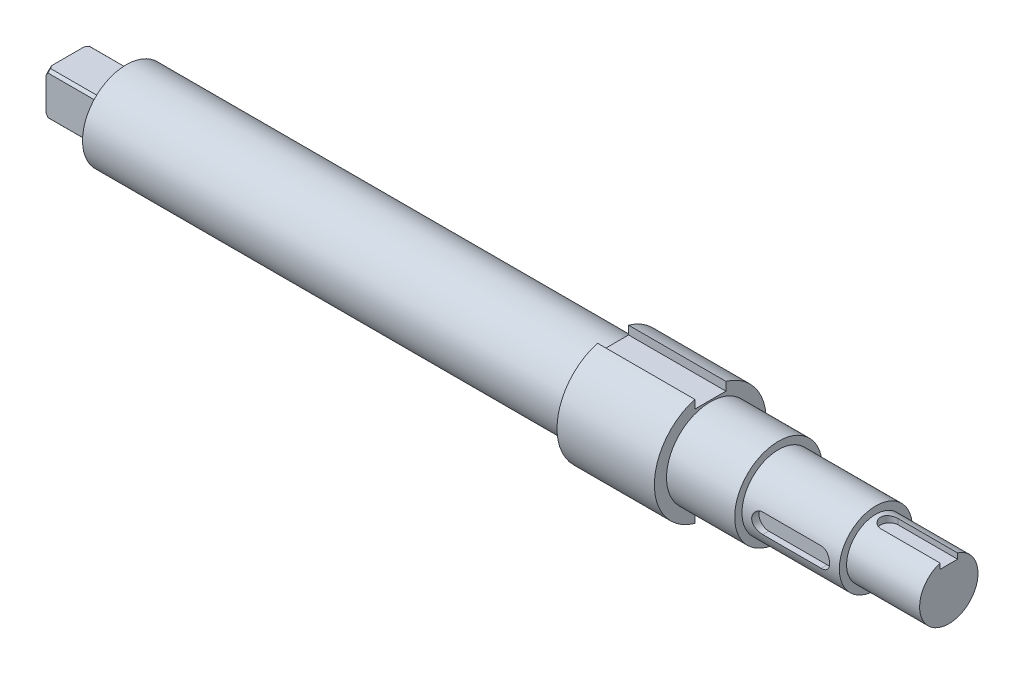
from build123d import *

# Parameters (mm, degrees)
SKETCH2_R          = 11.5
EXTRUDE1_DEPTH     = 20
SKETCH3_R          = 9
EXTRUDE2_DEPTH     = 14
SKETCH4_R          = 7.5
EXTRUDE3_DEPTH     = 20
SKETCH5_R          = 6
EXTRUDE4_DEPTH     = 15
EXTRUDE5_START     = 100
SKETCH6_R          = 9
EXTRUDE5_DEPTH     = 100
EXTRUDE6_START     = 12
SKETCH7_R          = 6
EXTRUDE6_DEPTH     = 12
SCALE1_SCALE       = 5
SKETCH9_W          = 32
SKETCH9_H          = 18
CUT_EXTRUDE1_DEPTH = 665.990601438
CUT_EXTRUDE2_DEPTH = 481.888860648
CUT_EXTRUDE3_DEPTH = 483.218372884
CHAMFER1_SIZE      = 2
SKETCH12_W         = 80
SKETCH12_H         = 80
SKETCH12_W_2       = 45
SKETCH12_H_2       = 45
CUT_EXTRUDE4_DEPTH = 50


with BuildPart() as part:
    # Sketch2 → Extrude1 (new body)
    with BuildSketch(Plane(origin=(0, 0, 0), x_dir=(0, 0, -1), z_dir=(1, 0, 0))):
        Circle(SKETCH2_R)
    extrude(amount=EXTRUDE1_DEPTH)

    # Sketch3 → Extrude2 (add)
    with BuildSketch(Plane(origin=(20, 0, 0), x_dir=(0, 0, -1), z_dir=(1, 0, 0))):
        Circle(SKETCH3_R)
    extrude(amount=EXTRUDE2_DEPTH)

    # Sketch4 → Extrude3 (add)
    with BuildSketch(Plane(origin=(34, 0, 0), x_dir=(0, 0, -1), z_dir=(1, 0, 0))):
        Circle(SKETCH4_R)
    extrude(amount=EXTRUDE3_DEPTH)

    # Sketch5 → Extrude4 (add)
    with BuildSketch(Plane(origin=(54, 0, 0), x_dir=(0, 0, -1), z_dir=(1, 0, 0))):
        Circle(SKETCH5_R)
    extrude(amount=EXTRUDE4_DEPTH)

    # Sketch6 → Extrude5 (add)
    with BuildSketch(Plane.ZY.offset(EXTRUDE5_START)):
        with Locations(Location((0, 0, 0), (0, 0, 180))):
            Circle(SKETCH6_R)
    extrude(amount=-EXTRUDE5_DEPTH)

    # Sketch7 → Extrude6 (add)
    with BuildSketch(Plane.ZY.offset(100).offset(EXTRUDE6_START)):
        with Locations(Location((0, 0, 0), (0, 0, 180))):
            Circle(SKETCH7_R)
    extrude(amount=-EXTRUDE6_DEPTH)


with BuildPart() as part_1:
    # Scale1: scaled about (-22.253434459, 0, 0)
    add(part.part.scale(SCALE1_SCALE).moved(Location((89.013737836, 0, 0))))

    # Sketch9 → Cut-Extrude1 (cut, through all)
    with BuildSketch(Plane(origin=(189.013737836, 0, 0), x_dir=(0, 0, -1), z_dir=(1, 0, 0))):
        with Locations((0, 55.5)):
            Rectangle(SKETCH9_W, SKETCH9_H)
    cut_extrude1 = extrude(amount=-CUT_EXTRUDE1_DEPTH, mode=Mode.SUBTRACT)

    # Mirror1: Cut-Extrude1 across plane
    add(cut_extrude1.mirror(Plane.ZX), mode=Mode.SUBTRACT)

    # Sketch10 → Cut-Extrude2 (cut, through all)
    with BuildSketch(Plane(origin=(0, 23, 0), x_dir=(-1, 0, 0), z_dir=(0, 1, 0))):
        with BuildLine():
            Line((-373.013737836, -9), (-434.013737836, -9))
            Line((-434.013737836, -9), (-434.013737836, 9))
            Line((-434.013737836, 9), (-373.013737836, 9))
            ThreePointArc((-373.013737836, 9), (-364.013737836, 0), (-373.013737836, -9))
        make_face()
    extrude(amount=CUT_EXTRUDE2_DEPTH, mode=Mode.SUBTRACT)

    # Sketch11 → Cut-Extrude3 (cut, through all)
    with BuildSketch(Plane(origin=(0, 0, 30), x_dir=(-1, 0, 0), z_dir=(0, 0, 1))):
        with BuildLine():
            Line((-339.013737836, 10), (-279.013737836, 10))
            ThreePointArc((-279.013737836, 10), (-269.013737836, 0), (-279.013737836, -10))
            Line((-279.013737836, -10), (-339.013737836, -10))
            ThreePointArc((-339.013737836, -10), (-349.013737836, 0), (-339.013737836, 10))
        make_face()
    extrude(amount=CUT_EXTRUDE3_DEPTH, mode=Mode.SUBTRACT)

    # Chamfer1
    chamfer1_edges = [part_1.edges().sort_by_distance(p)[0] for p in [
        (-470.986262164, 0, 30),
    ]]
    chamfer(chamfer1_edges, length=CHAMFER1_SIZE)

    # Sketch12 → Cut-Extrude4 (cut)
    with BuildSketch(Plane.ZY.offset(470.986262164)):
        Rectangle(SKETCH12_W, SKETCH12_H)
        Rectangle(SKETCH12_W_2, SKETCH12_H_2, mode=Mode.SUBTRACT)
    extrude(amount=-CUT_EXTRUDE4_DEPTH, mode=Mode.SUBTRACT)


solid = part_1.part
